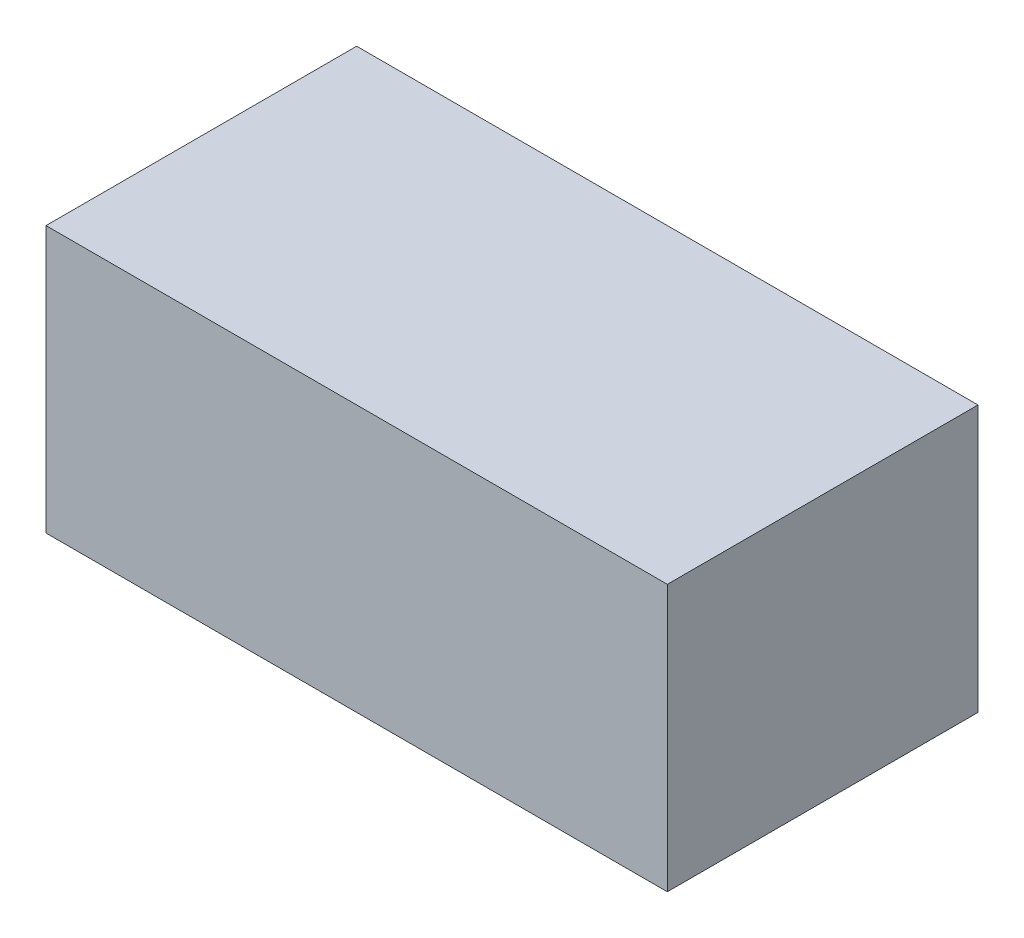
from build123d import *

# Parameters (mm, degrees)
SKETCH1_W           = 35
SKETCH1_H           = 30
BOSS_EXTRUDE1_DEPTH = 70


with BuildPart() as part:
    # Sketch1 → Boss-Extrude1 (new body)
    with BuildSketch(Plane(origin=(0, 0, 0), x_dir=(0, 0, -1), z_dir=(1, 0, 0))):
        with Locations((17.5, 15)):
            Rectangle(SKETCH1_W, SKETCH1_H)
    extrude(amount=BOSS_EXTRUDE1_DEPTH)


solid = part.part
